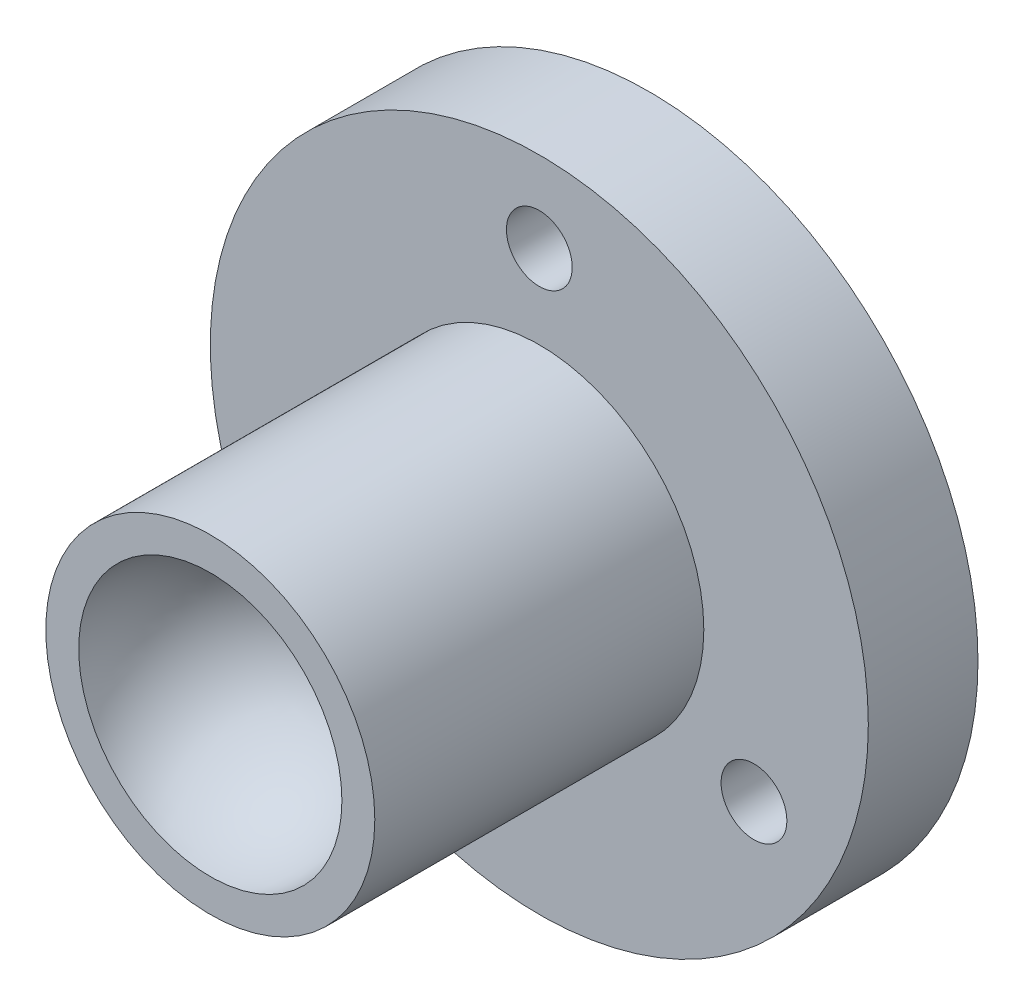
from build123d import *

# Parameters (mm, degrees)
SKETCH1_R           = 7.5
SKETCH1_R_2         = 6
BOSS_EXTRUDE1_DEPTH = 20
SKETCH1_4_R         = 6
BOSS_EXTRUDE2_DEPTH = 20
SKETCH1_5_R         = 15
SKETCH1_5_R_2       = 7.5
BOSS_EXTRUDE3_DEPTH = 5
SKETCH3_R           = 1.5
CUT_EXTRUDE1_DEPTH  = 11
SCALE1_SCALE        = 0.5
SCALE2_SCALE        = 1.25
SCALE3_SCALE        = 1.1


with BuildPart() as part:
    # Sketch1 → Boss-Extrude1 (new body)
    with BuildSketch(Plane.XY):
        Circle(SKETCH1_R)
        Circle(SKETCH1_R_2, mode=Mode.SUBTRACT)
    extrude(amount=BOSS_EXTRUDE1_DEPTH)

    # Sketch1<4> → Boss-Extrude2 (add)
    with BuildSketch(Plane.XY):
        Circle(SKETCH1_4_R)
    extrude(amount=BOSS_EXTRUDE2_DEPTH)

    # Sketch1<5> → Boss-Extrude3 (add)
    with BuildSketch(Plane.XY):
        Circle(SKETCH1_5_R)
        Circle(SKETCH1_5_R_2, mode=Mode.SUBTRACT)
    extrude(amount=BOSS_EXTRUDE3_DEPTH)

    # Sketch2 → Cut-Revolve1 (revolve, cut)
    with BuildSketch(Plane.XY.offset(20)):
        with BuildLine():
            Line((0, 6), (0, -6))
            ThreePointArc((0, -6), (6, 0), (0, 6))
        make_face()
    revolve(axis=Axis((0, 13.785304087, 20), (0, -1, 0)), mode=Mode.SUBTRACT)

    # Sketch3 → Cut-Extrude1 (cut)
    with BuildSketch(Plane.XY.offset(5)):
        with Locations((0, 11.3)):
            Circle(SKETCH3_R)
        with Locations((9.786087063, -5.65)):
            Circle(SKETCH3_R)
        with Locations((-9.786087063, -5.65)):
            Circle(SKETCH3_R)
    extrude(amount=-CUT_EXTRUDE1_DEPTH, mode=Mode.SUBTRACT)


with BuildPart() as part_1:
    # Scale1: scaled about (0, 0, 5.984924623)
    add(part.part.scale(SCALE1_SCALE).moved(Location((0, 0, 2.992462312))))


with BuildPart() as part_2:
    # Scale2: scaled about (0, 0, 5.984924623)
    add(part_1.part.scale(SCALE2_SCALE).moved(Location((0, 0, -1.496231156))))


with BuildPart() as part_3:
    # Scale3: scaled about (0, 0, 5.984924623)
    add(part_2.part.scale(SCALE3_SCALE).moved(Location((0, 0, -0.598492462))))


solid = part_3.part
